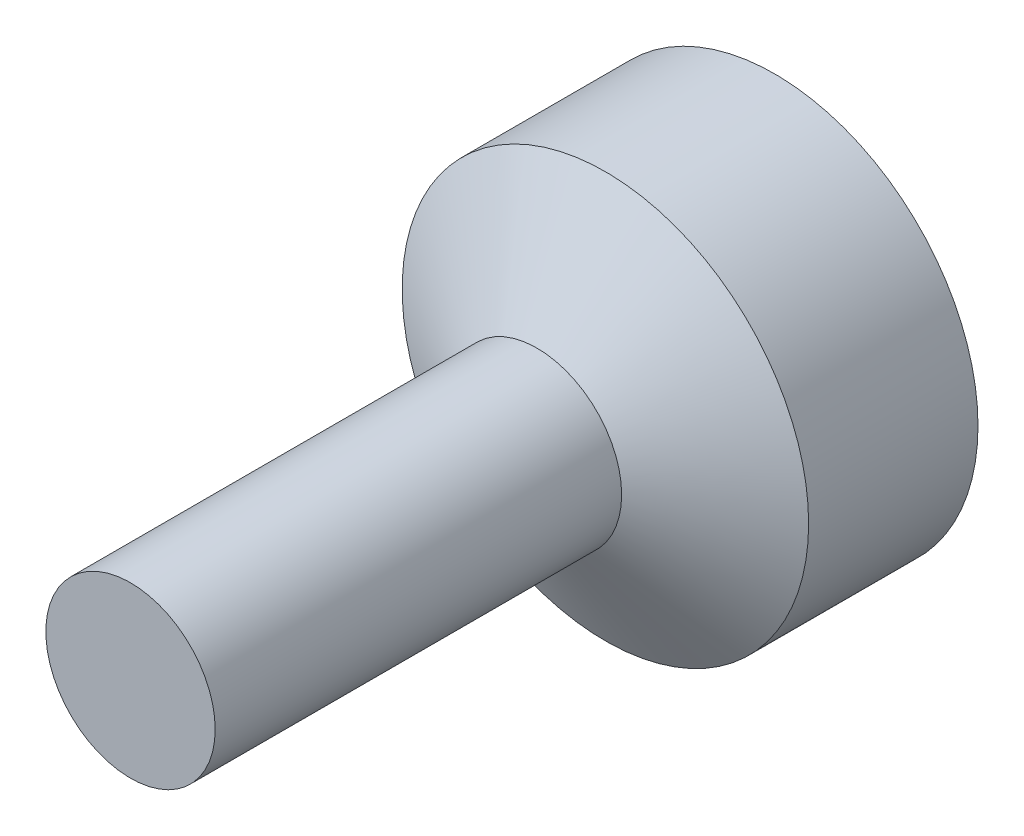
from build123d import *


with BuildPart() as part:
    # Sketch1 → Revolve1 (revolve)
    with BuildSketch(Plane(origin=(0, 0, 0), x_dir=(1, 0, 0), z_dir=(0, 1, 0))):
        Polygon((0, 0), (3.048, 0), (3.048, -2.54), (1.27, -3.566528779), (1.27, -9.662528779), (0, -9.662528779), align=None)
    revolve(axis=Axis((0, 0, 9.662528779), (0, 0, -1)))


solid = part.part
